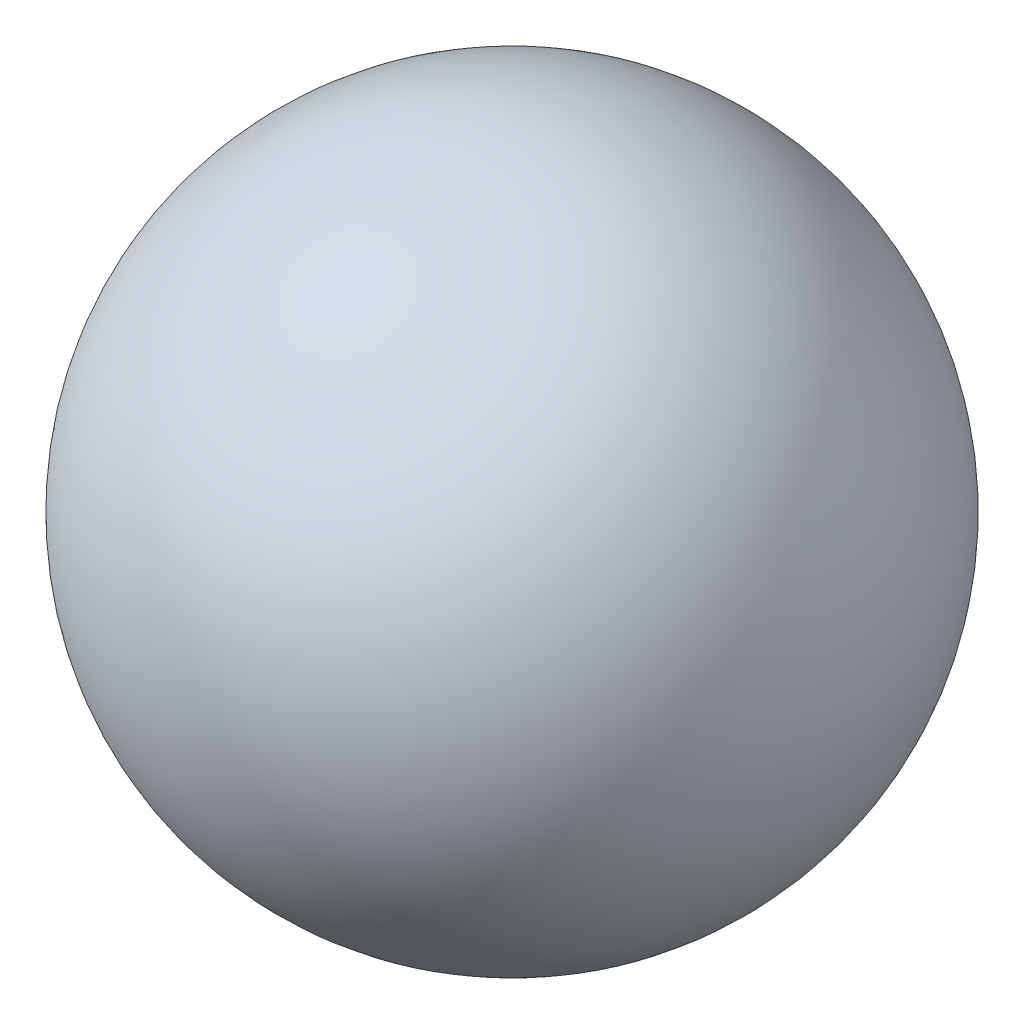
from build123d import *


with BuildPart() as part:
    # 草图1 → 旋转1 (revolve)
    with BuildSketch(Plane.XY):
        with BuildLine():
            Line((0, 21.25), (0, -21.25))
            ThreePointArc((0, -21.25), (21.25, 0), (0, 21.25))
        make_face()
    revolve(axis=Axis((0, 21.25, 0), (0, -1, 0)))


solid = part.part
